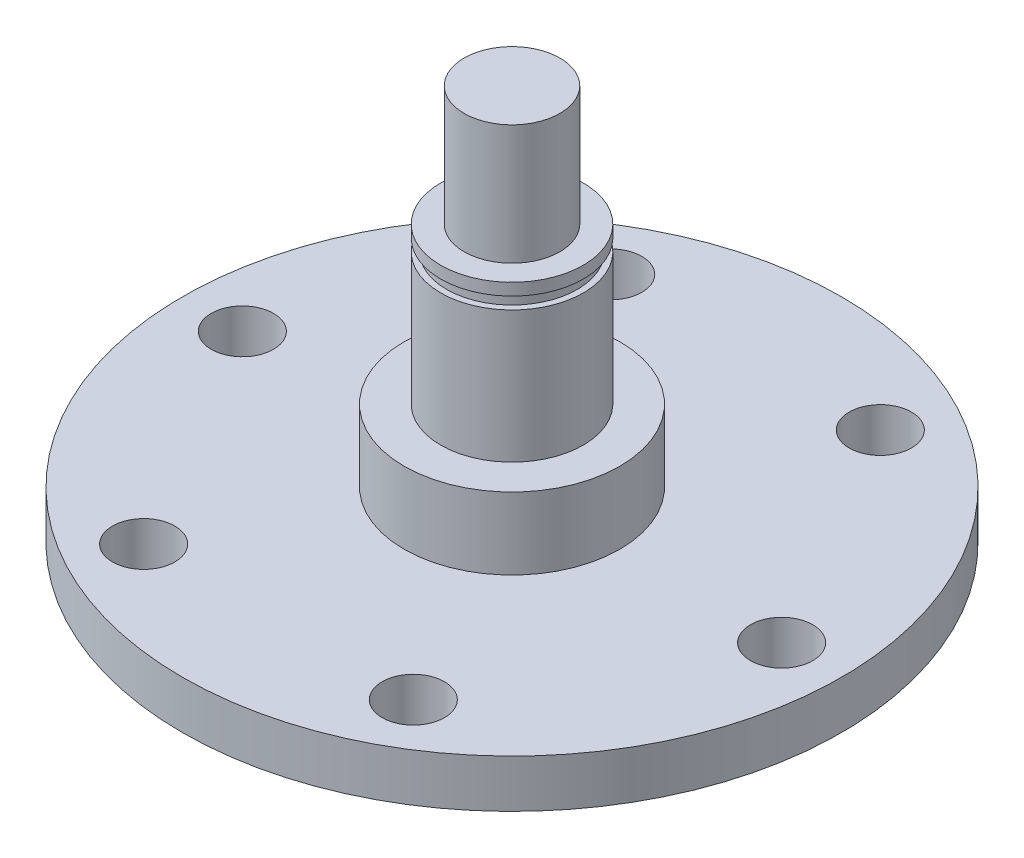
from build123d import *

# Parameters (mm, degrees)
SKETCH_2_R          = 2.6
CUT_EXTRUDE_1_DEPTH = 49.512884886


with BuildPart() as part:
    # 草图1 → 旋转1 (revolve)
    with BuildSketch(Plane.XY, mode=Mode.PRIVATE) as revolve_1_sk:
        Polygon((0, 0), (27.5, 0), (27.5, 4), (9, 4), (9, 10), (5.95, 10), (5.95, 21), (5.45, 21), (5.45, 22), (5.95, 22), (5.95, 23), (4, 23), (4, 33), (0, 33), (0, 23.5), align=None)
    revolve(revolve_1_sk.sketch.rotate(Axis((0, 23.5, 0), (0, -1, 0)), 90), axis=Axis((0, 23.5, 0), (0, -1, 0)))

    # 草图2 → 切除-拉伸1 (cut, through all)
    with BuildSketch(Plane(origin=(0, 4, 0), x_dir=(1, 0, 0), z_dir=(0, 1, 0))):
        with Locations(Location((22.5, 0, 0), (0, 0, 270))):
            Circle(SKETCH_2_R)
        with Locations(Location((11.25, -19.485571585, 0), (0, 0, 270))):
            Circle(SKETCH_2_R)
        with Locations(Location((-11.25, -19.485571585, 0), (0, 0, 270))):
            Circle(SKETCH_2_R)
        with Locations(Location((-22.5, 0, 0), (0, 0, 270))):
            Circle(SKETCH_2_R)
        with Locations(Location((-11.25, 19.485571585, 0), (0, 0, 270))):
            Circle(SKETCH_2_R)
        with Locations(Location((11.25, 19.485571585, 0), (0, 0, 270))):
            Circle(SKETCH_2_R)
    extrude(amount=-CUT_EXTRUDE_1_DEPTH, mode=Mode.SUBTRACT)


solid = part.part
